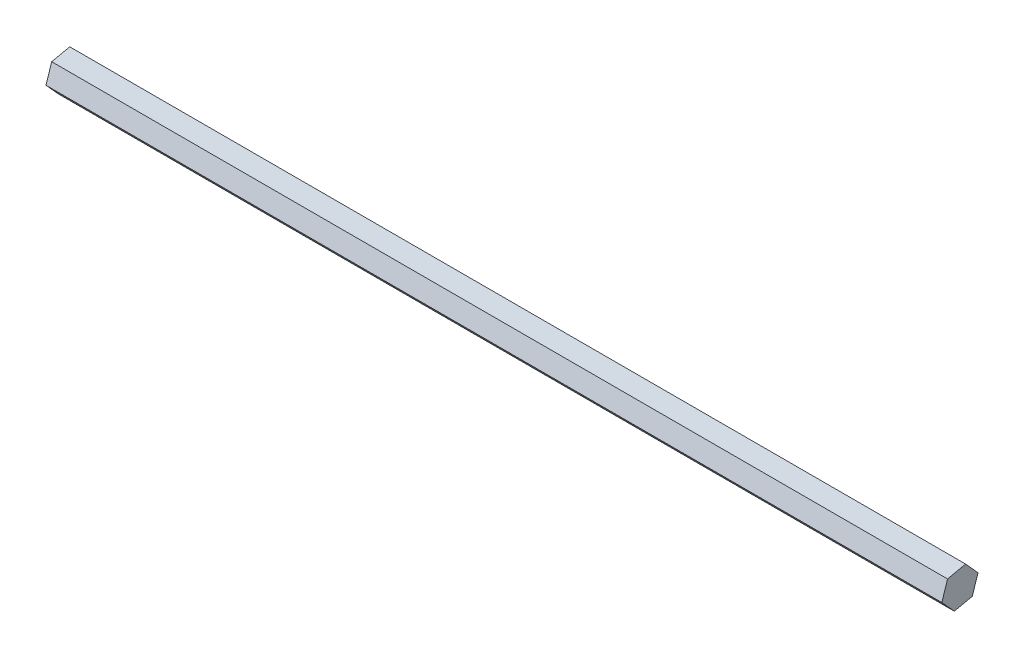
from build123d import *

# Parameters (mm, degrees)
BOSS_EXTRUDE1_DEPTH      = 177.8
BOSS_EXTRUDE1_DEPTH_BACK = 177.8


with BuildPart() as part:
    # Sketch1 → Boss-Extrude1 (new, two sides: drawn at the far end of the back side and taken through both)
    with BuildSketch(Plane(origin=(0, 0, 0), x_dir=(0, 0, -1), z_dir=(1, 0, 0)).offset(-BOSS_EXTRUDE1_DEPTH_BACK)):
        Polygon((-27.78524472, -21.359958801), (-20.615524297, -19.824236697), (-18.360638439, -12.847215621), (-23.275473006, -7.405916647), (-30.445193429, -8.94163875), (-32.700079287, -15.918659827), align=None)
    extrude(amount=BOSS_EXTRUDE1_DEPTH + BOSS_EXTRUDE1_DEPTH_BACK)


solid = part.part
